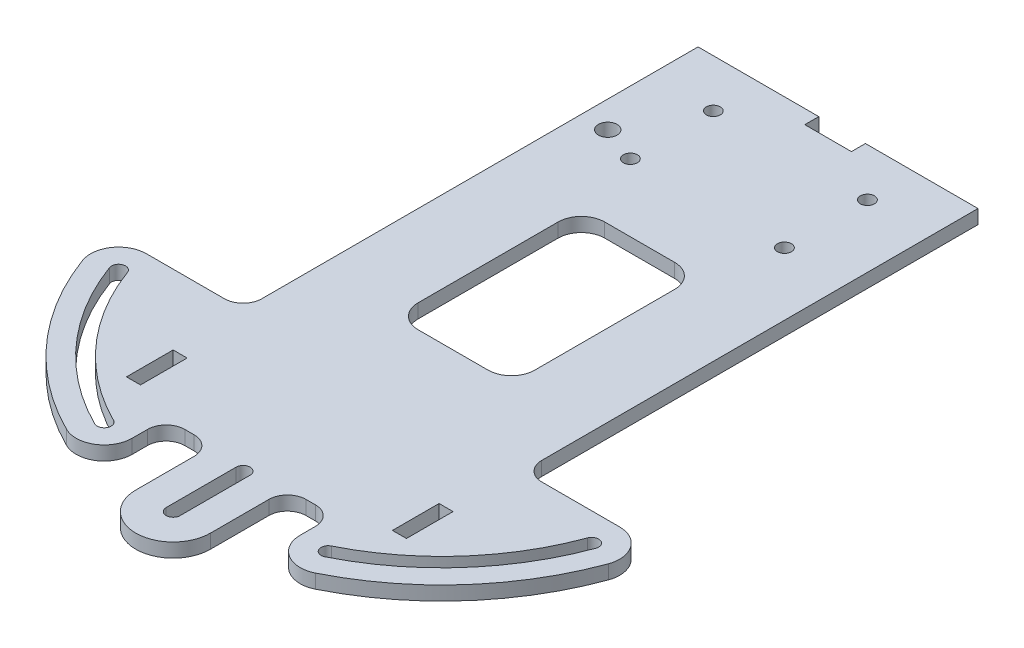
from build123d import *

# Parameters (mm, degrees)
CROQUIS1_R              = 2
CROQUIS1_R_2            = 1.5
CROQUIS1_W              = 3
CROQUIS1_H              = 10
SALIENTE_EXTRUIR1_DEPTH = 3


with BuildPart() as part:
    # Croquis1 → Saliente-Extruir1 (new body)
    with BuildSketch(Plane(origin=(0, 0, 0), x_dir=(1, 0, 0), z_dir=(0, 1, 0))):
        with BuildLine():
            Line((-30, -21.975186569), (-30, 62.5))
            Line((-30, 62.5), (-4.123983247, 62.5))
            Line((-4.123983247, 62.5), (-4.123983247, 59.5))
            Line((-4.123983247, 59.5), (5.876016753, 59.5))
            Line((5.876016753, 59.5), (5.876016753, 62.5))
            Line((5.876016753, 62.5), (30, 62.5))
            Line((30, 62.5), (30, -21.975186569))
            Line((30, -21.975186569), (30, -31))
            ThreePointArc((30, -31), (31.171572875, -33.828427125), (34, -35))
            Line((34, -35), (50.699653605, -35))
            ThreePointArc((50.699653605, -35), (55.61862518, -37.564345966), (56.332948449, -43.06542712))
            ThreePointArc((56.332948449, -43.06542712), (44.677053609, -62.460636323), (26.666666667, -76.159540905))
            ThreePointArc((26.666666667, -76.159540905), (20.83772234, -75.883721919), (18, -70.784702406))
            Line((18, -70.784702406), (18, -67.5))
            ThreePointArc((18, -67.5), (16.828427125, -64.671572875), (14, -63.5))
            Line((14, -63.5), (12, -63.5))
            ThreePointArc((12, -63.5), (9.171572875, -64.671572875), (8, -67.5))
            Line((8, -67.5), (8, -80))
            ThreePointArc((8, -80), (0, -88), (-8, -80))
            Line((-8, -80), (-8, -67.5))
            ThreePointArc((-8, -67.5), (-9.171572875, -64.671572875), (-12, -63.5))
            Line((-12, -63.5), (-14, -63.5))
            ThreePointArc((-14, -63.5), (-16.828427125, -64.671572875), (-18, -67.5))
            Line((-18, -67.5), (-18, -70.784702406))
            ThreePointArc((-18, -70.784702406), (-20.83772234, -75.883721919), (-26.666666667, -76.159540905))
            ThreePointArc((-26.666666667, -76.159540905), (-44.677053609, -62.460636323), (-56.332948449, -43.06542712))
            ThreePointArc((-56.332948449, -43.06542712), (-55.61862518, -37.564345966), (-50.699653605, -35))
            Line((-50.699653605, -35), (-34, -35))
            ThreePointArc((-34, -35), (-31.171572875, -33.828427125), (-30, -31))
            Line((-30, -31), (-30, -21.975186569))
        make_face()
        with Locations(Location((-24.3, 37.439181633, 0), (0, 0, 270))):
            Circle(CROQUIS1_R, mode=Mode.SUBTRACT)
        with Locations(Location((16.54, 52.26006939, 0), (0, 0, 270))):
            Circle(CROQUIS1_R_2, mode=Mode.SUBTRACT)
        with Locations(Location((16.54, 34.48006939, 0), (0, 0, 270))):
            Circle(CROQUIS1_R_2, mode=Mode.SUBTRACT)
        with Locations(Location((-16.48, 34.48006939, 0), (0, 0, 270))):
            Circle(CROQUIS1_R_2, mode=Mode.SUBTRACT)
        with Locations(Location((-16.48, 52.26006939, 0), (0, 0, 270))):
            Circle(CROQUIS1_R_2, mode=Mode.SUBTRACT)
        with Locations((28.5, -55)):
            Rectangle(CROQUIS1_W, CROQUIS1_H, mode=Mode.SUBTRACT)
        with Locations((-28.5, -55)):
            Rectangle(CROQUIS1_W, CROQUIS1_H, mode=Mode.SUBTRACT)
        with BuildLine():
            Line((1.5, -65), (1.5, -80))
            ThreePointArc((1.5, -80), (0, -81.5), (-1.5, -80))
            Line((-1.5, -80), (-1.5, -65))
            ThreePointArc((-1.5, -65), (0, -63.5), (1.5, -65))
        make_face(mode=Mode.SUBTRACT)
        with BuildLine():
            Line((7.5, -20), (-7.5, -20))
            ThreePointArc((-7.5, -20), (-11.035533906, -18.535533906), (-12.5, -15))
            Line((-12.5, -15), (-12.5, 15))
            ThreePointArc((-12.5, 15), (-11.035533906, 18.535533906), (-7.5, 20))
            Line((-7.5, 20), (7.5, 20))
            ThreePointArc((7.5, 20), (11.035533906, 18.535533906), (12.5, 15))
            Line((12.5, 15), (12.5, -15))
            ThreePointArc((12.5, -15), (11.035533906, -18.535533906), (7.5, -20))
        make_face(mode=Mode.SUBTRACT)
        with BuildLine():
            ThreePointArc((-52.107977316, -41.51635678), (-41.326274588, -59.456925292), (-24.666666667, -72.12841203))
            ThreePointArc((-24.666666667, -72.12841203), (-22.656290375, -71.451369072), (-23.333333333, -69.440992781))
            ThreePointArc((-23.333333333, -69.440992781), (-39.092421908, -57.454451272), (-49.291329893, -40.48364322))
            ThreePointArc((-49.291329893, -40.48364322), (-51.216010385, -39.591676289), (-52.107977316, -41.51635678))
        make_face(mode=Mode.SUBTRACT)
        with BuildLine():
            ThreePointArc((52.107977316, -41.51635678), (41.326274588, -59.456925292), (24.666666667, -72.12841203))
            ThreePointArc((24.666666667, -72.12841203), (22.656290375, -71.451369072), (23.333333333, -69.440992781))
            ThreePointArc((23.333333333, -69.440992781), (39.092421908, -57.454451272), (49.291329893, -40.48364322))
            ThreePointArc((49.291329893, -40.48364322), (51.216010385, -39.591676289), (52.107977316, -41.51635678))
        make_face(mode=Mode.SUBTRACT)
    extrude(amount=SALIENTE_EXTRUIR1_DEPTH)


solid = part.part
